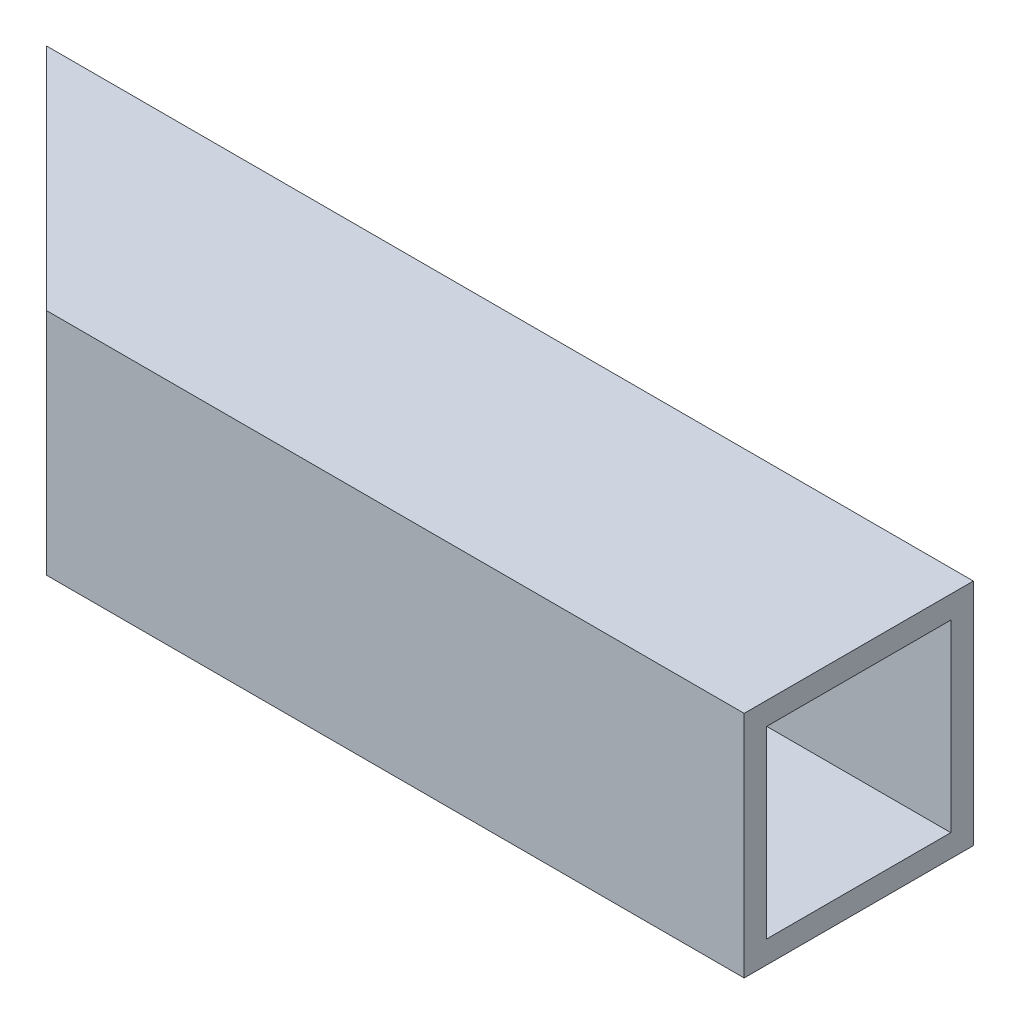
from build123d import *

# Parameters (mm, degrees)
SKETCH2_W           = 25.4
SKETCH2_H           = 25.4
SKETCH2_W_2         = 20.4
SKETCH2_H_2         = 20.4
BOSS_EXTRUDE1_DEPTH = 102.7
CUT_EXTRUDE1_DEPTH  = 107.553930007


with BuildPart() as part:
    # Sketch2 → Boss-Extrude1 (new body)
    with BuildSketch(Plane(origin=(0, 0, 0), x_dir=(0, 0, -1), z_dir=(1, 0, 0))):
        Rectangle(SKETCH2_W, SKETCH2_H)
        Rectangle(SKETCH2_W_2, SKETCH2_H_2, mode=Mode.SUBTRACT)
    extrude(amount=BOSS_EXTRUDE1_DEPTH)

    # Sketch3 → Cut-Extrude1 (cut, through all)
    with BuildSketch(Plane(origin=(0, 12.7, 0), x_dir=(1, 0, 0), z_dir=(0, 1, 0))):
        Polygon((0, -12.7), (0, 12.7), (25.4, -12.7), align=None)
    extrude(amount=-CUT_EXTRUDE1_DEPTH, mode=Mode.SUBTRACT)


solid = part.part
